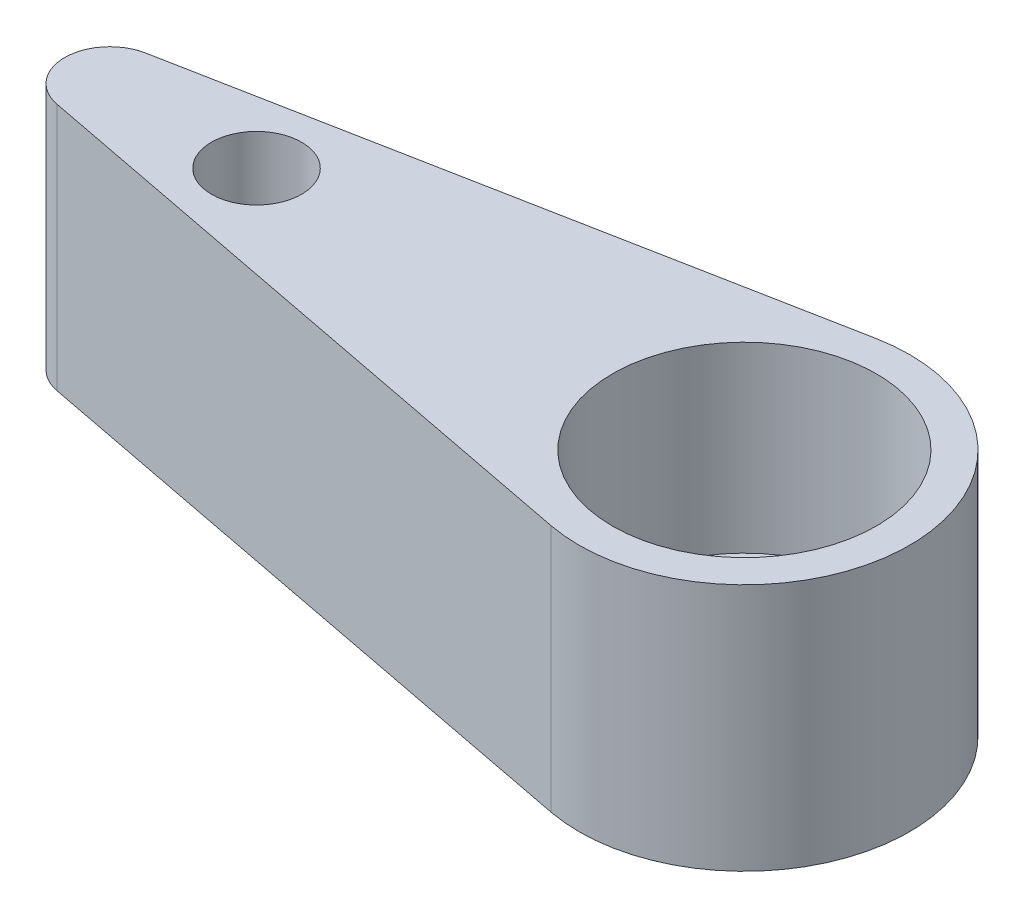
from build123d import *

# Parameters (mm, degrees)
EXTRUDE_4_DEPTH      = 5.5
SKETCH_8_R           = 2.925
CUT_EXTRUDE_8_DEPTH  = 4.05
SKETCH_9_R           = 1
CUT_EXTRUDE_9_DEPTH  = 17.451421165
SKETCH_10_R          = 1
CUT_EXTRUDE_10_DEPTH = 17.025035362


with BuildPart() as part:
    # 草图1 → 凸台-拉伸4 (new body)
    with BuildSketch(Plane(origin=(0, 0, 0), x_dir=(1, 0, 0), z_dir=(0, 1, 0))):
        with BuildLine():
            ThreePointArc((3.662209834, 0), (2.331674388, 2.824017602), (-0.693125212, 3.596019787))
            Line((-0.693125212, 3.596019787), (-0.693125212, 0))
            Line((-0.693125212, 0), (3.662209834, 0))
        make_face()
        with BuildLine():
            Line((-0.693125212, 0), (-0.693125212, 3.596019787))
            ThreePointArc((-0.693125212, 3.596019787), (-2.824017602, 2.331674388), (-3.662209834, 0))
            Line((-3.662209834, 0), (-0.693125212, 0))
        make_face()
        with BuildLine():
            Line((3.662209834, 0), (-0.693125212, 0))
            Line((-0.693125212, 0), (-0.693125212, -3.596019787))
            ThreePointArc((-0.693125212, -3.596019787), (2.331674388, -2.824017602), (3.662209834, 0))
        make_face()
        with BuildLine():
            Line((-0.693125212, -3.596019787), (-0.693125212, 0))
            Line((-0.693125212, 0), (-3.662209834, 0))
            ThreePointArc((-3.662209834, 0), (-2.824017602, -2.331674388), (-0.693125212, -3.596019787))
        make_face()
        with BuildLine():
            ThreePointArc((-3.662209834, 0), (-2.824017602, 2.331674388), (-0.693125212, 3.596019787))
            Line((-0.693125212, 3.596019787), (-14.255367792, 0.9819262))
            ThreePointArc((-14.255367792, 0.9819262), (-15.066103593, 0), (-14.255367792, -0.9819262))
            Line((-14.255367792, -0.9819262), (-0.693125212, -3.596019787))
            ThreePointArc((-0.693125212, -3.596019787), (-2.824017602, -2.331674388), (-3.662209834, 0))
        make_face()
    extrude(amount=EXTRUDE_4_DEPTH)

    # 草图8 → 切除-拉伸8 (cut)
    with BuildSketch(Plane(origin=(0, 5.5, 0), x_dir=(1, 0, 0), z_dir=(0, 1, 0))):
        with Locations(Location((0, 0, 0), (0, 0, 270))):
            Circle(SKETCH_8_R)
    extrude(amount=-CUT_EXTRUDE_8_DEPTH, mode=Mode.SUBTRACT)

    # 草图9 → 切除-拉伸9 (cut, through all)
    with BuildSketch(Plane(origin=(0, 5.5, 0), x_dir=(1, 0, 0), z_dir=(0, 1, 0))):
        with Locations(Location((-10.814314949, 0, 0), (0, 0, 270))):
            Circle(SKETCH_9_R)
    extrude(amount=-CUT_EXTRUDE_9_DEPTH, mode=Mode.SUBTRACT)

    # 草图10 → 切除-拉伸10 (cut, through all)
    with BuildSketch(Plane(origin=(0, 1.45, 0), x_dir=(1, 0, 0), z_dir=(0, 1, 0))):
        with Locations(Location((0, 0, 0), (0, 0, 270))):
            Circle(SKETCH_10_R)
    extrude(amount=-CUT_EXTRUDE_10_DEPTH, mode=Mode.SUBTRACT)


solid = part.part
